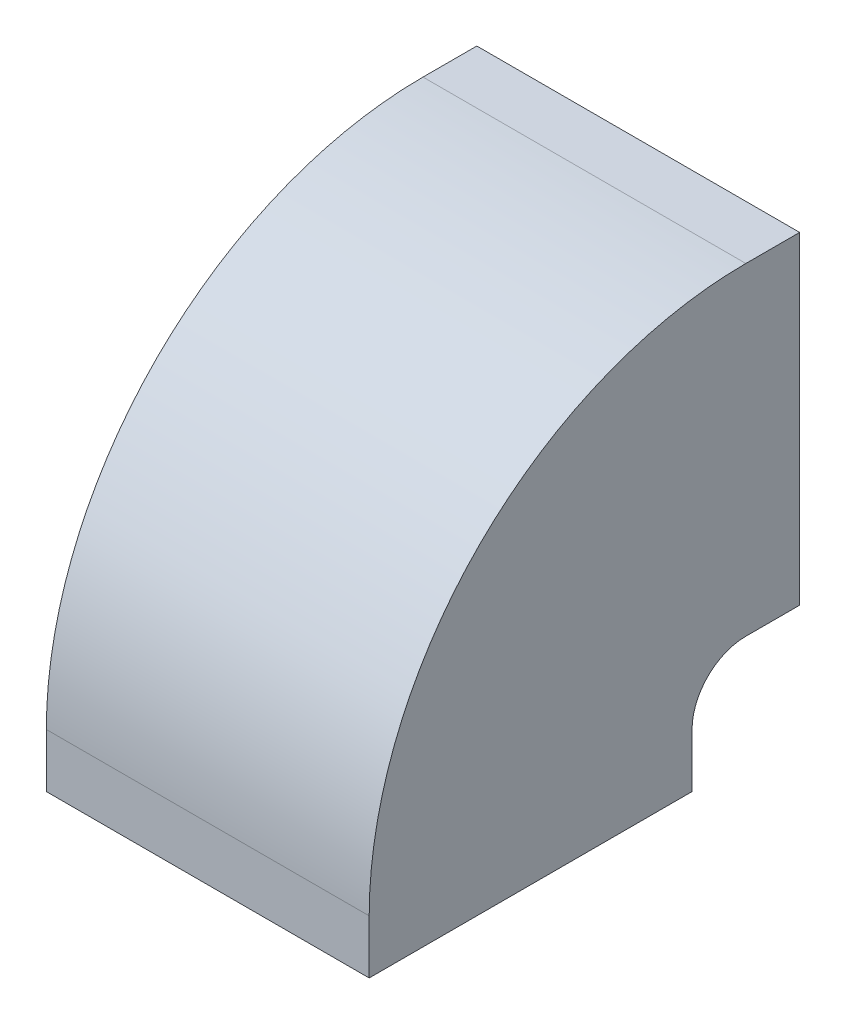
from build123d import *

# Parameters (mm, degrees)
BOSS_EXTRUDE1_DEPTH = 152.4
SHELL1_T            = -2.54
SKETCH2_W           = 147.32
SKETCH2_H           = 147.32
CUT_EXTRUDE2_DEPTH  = 152.4


with BuildPart() as part:
    # Sketch1 → Boss-Extrude1 (new body)
    with BuildSketch(Plane(origin=(0, 0, 0), x_dir=(0, 0, -1), z_dir=(1, 0, 0))):
        with BuildLine():
            Line((0, 0), (152.4, 0))
            Line((152.4, 0), (152.4, 25.4))
            ThreePointArc((152.4, 25.4), (159.839487758, 43.360512242), (177.8, 50.8))
            Line((177.8, 50.8), (203.2, 50.8))
            Line((203.2, 50.8), (203.2, 203.2))
            Line((203.2, 203.2), (177.8, 203.2))
            ThreePointArc((177.8, 203.2), (52.076414305, 151.123585695), (0, 25.4))
            Line((0, 25.4), (0, 0))
        make_face()
    extrude(amount=BOSS_EXTRUDE1_DEPTH)

    # Shell1
    shell1_openings = [part.faces().sort_by_distance(p)[0] for p in [
        (76.2, 127, -203.2),
    ]]
    offset(amount=SHELL1_T, openings=shell1_openings, kind=Kind.INTERSECTION)

    # Sketch2 → Cut-Extrude2 (cut)
    with BuildSketch(Plane(origin=(0, 2.54, 0), x_dir=(1, 0, 0), z_dir=(0, 1, 0))):
        with Locations((76.2, 76.2)):
            Rectangle(SKETCH2_W, SKETCH2_H)
    extrude(amount=-CUT_EXTRUDE2_DEPTH, mode=Mode.SUBTRACT)


solid = part.part
